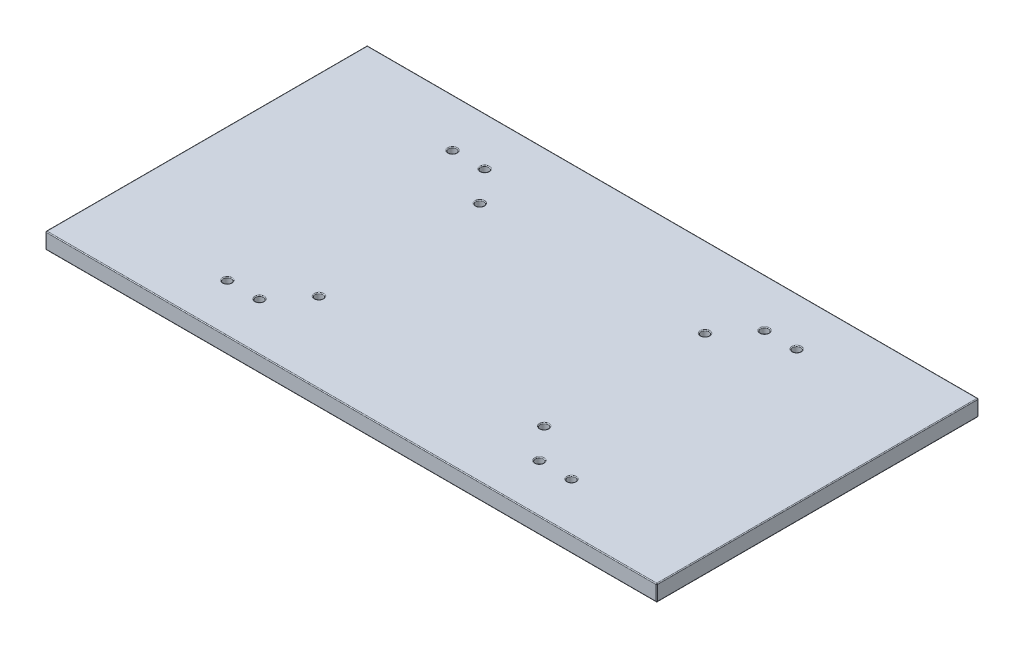
from build123d import *

# Parameters (mm, degrees)
SKETCH1_W           = 190
SKETCH1_H           = 100
SKETCH1_R           = 1.25
BOSS_EXTRUDE1_DEPTH = 5
FILLET1_R           = 0.25


with BuildPart() as part:
    # Sketch1 → Boss-Extrude1 (new body)
    with BuildSketch(Plane(origin=(0, 0, 0), x_dir=(1, 0, 0), z_dir=(0, 1, 0))):
        Rectangle(SKETCH1_W, SKETCH1_H)
        with Locations(Location((-35, 25, 0), (0, 0, 270))):
            Circle(SKETCH1_R, mode=Mode.SUBTRACT)
        with Locations(Location((-35, -25, 0), (0, 0, 270))):
            Circle(SKETCH1_R, mode=Mode.SUBTRACT)
        with Locations(Location((35, 25, 0), (0, 0, 270))):
            Circle(SKETCH1_R, mode=Mode.SUBTRACT)
        with Locations(Location((-53.5, -35, 0), (0, 0, 270))):
            Circle(SKETCH1_R, mode=Mode.SUBTRACT)
        with Locations(Location((-43.5, -35, 0), (0, 0, 270))):
            Circle(SKETCH1_R, mode=Mode.SUBTRACT)
        with Locations(Location((35, -25, 0), (0, 0, 90))):
            Circle(SKETCH1_R, mode=Mode.SUBTRACT)
        with Locations(Location((43.5, -35, 0), (0, 0, 90))):
            Circle(SKETCH1_R, mode=Mode.SUBTRACT)
        with Locations(Location((53.5, -35, 0), (0, 0, 90))):
            Circle(SKETCH1_R, mode=Mode.SUBTRACT)
        with Locations(Location((53.5, 35, 0), (0, 0, 270))):
            Circle(SKETCH1_R, mode=Mode.SUBTRACT)
        with Locations(Location((43.5, 35, 0), (0, 0, 270))):
            Circle(SKETCH1_R, mode=Mode.SUBTRACT)
        with Locations(Location((-43.5, 35, 0), (0, 0, 90))):
            Circle(SKETCH1_R, mode=Mode.SUBTRACT)
        with Locations(Location((-53.5, 35, 0), (0, 0, 90))):
            Circle(SKETCH1_R, mode=Mode.SUBTRACT)
    extrude(amount=BOSS_EXTRUDE1_DEPTH)

    # Fillet1
    fillet1_edges = [part.edges().sort_by_distance(p)[0] for p in [
        (-53.5, 0, 33.75),
        (-53.5, 5, 33.75),
        (0, 5, -50),
        (-43.5, 0, 33.75),
        (-43.5, 5, 33.75),
        (-95, 5, 0),
        (-35, 0, 23.75),
        (-35, 5, 23.75),
        (-53.5, 5, -33.75),
        (-53.5, 0, -33.75),
        (-43.5, 5, -33.75),
        (-43.5, 0, -33.75),
        (-35, 0, -26.25),
        (-35, 5, -26.25),
        (35, 5, 26.25),
        (35, 0, 26.25),
        (43.5, 5, 36.25),
        (43.5, 0, 36.25),
        (53.5, 5, 36.25),
        (53.5, 0, 36.25),
        (35, 0, -26.25),
        (35, 5, -26.25),
        (0, 5, 50),
        (-95, 0, 0),
        (43.5, 0, -36.25),
        (43.5, 5, -36.25),
        (0, 0, -50),
        (53.5, 0, -36.25),
        (53.5, 5, -36.25),
        (95, 0, 0),
        (0, 0, 50),
        (-95, 2.5, 50),
        (-95, 2.5, -50),
        (95, 2.5, -50),
        (95, 2.5, 50),
        (95, 5, 0),
    ]]
    fillet(fillet1_edges, radius=FILLET1_R)


solid = part.part
